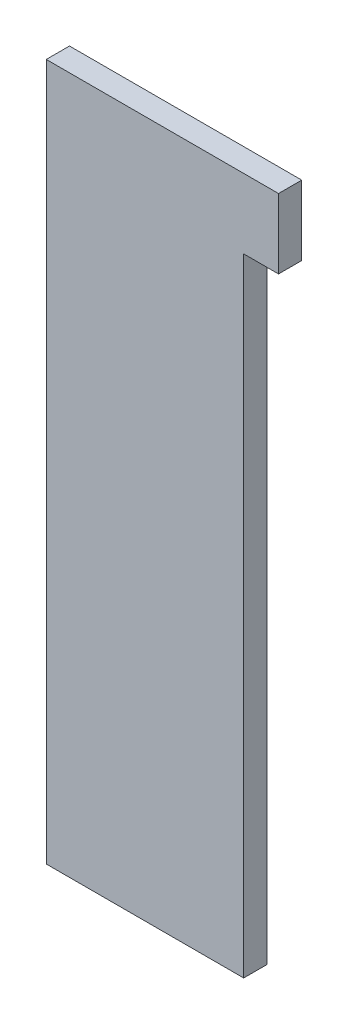
from build123d import *

# Parameters (mm, degrees)
BOSS_EXTRUDE1_DEPTH = 2


with BuildPart() as part:
    # Sketch1 → Boss-Extrude1 (new body)
    with BuildSketch(Plane.XY):
        Polygon((0, 0), (17, 0), (17, 54), (20, 54), (20, 60), (16.567164179, 60), (0, 60), align=None)
    extrude(amount=BOSS_EXTRUDE1_DEPTH)


solid = part.part
